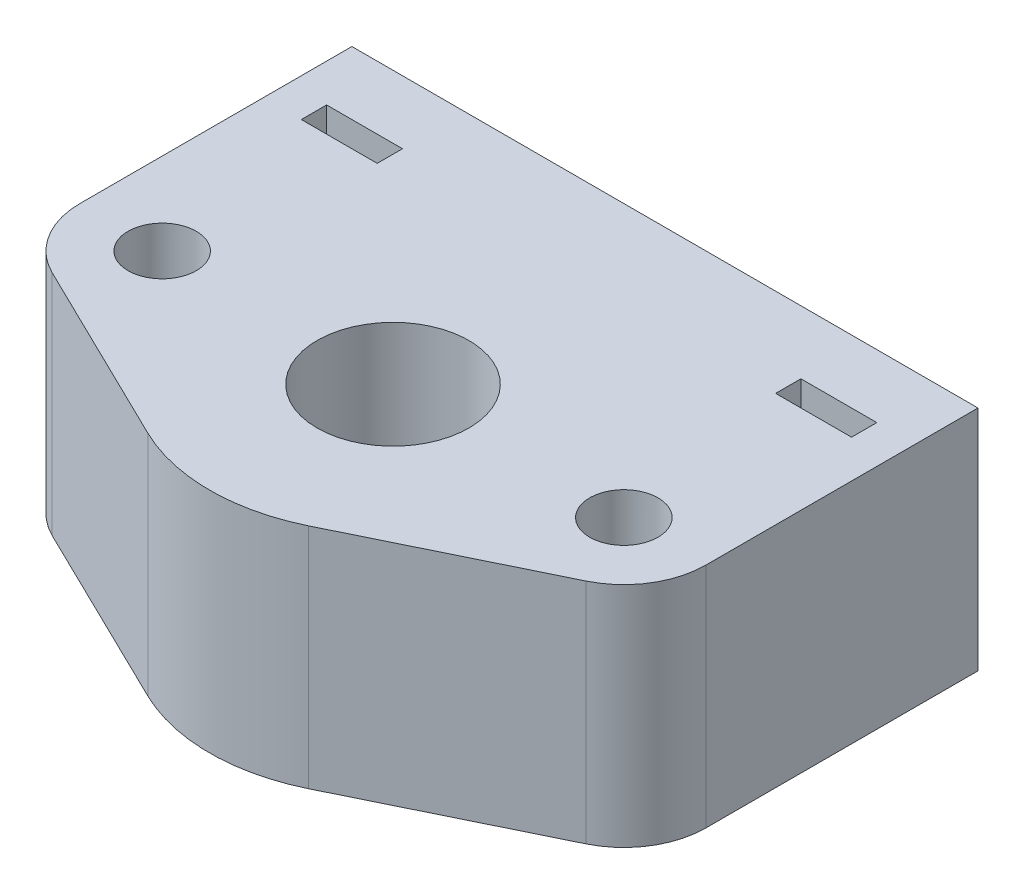
from build123d import *
from build123d.topology import SkipClean

# Parameters (mm, degrees)
BOSS_EXTRUDE1_DEPTH      = 12
BOSS_EXTRUDE1_DEPTH_BACK = 6
SKETCH1_R                = 2.7
SKETCH3_R                = 1.7
CUT_EXTRUDE1_DEPTH       = 10
CUT_EXTRUDE2_START       = -5
CUT_EXTRUDE2_DEPTH       = 2
CUT_EXTRUDE3_DEPTH       = 10


with BuildPart() as part:
    # Sketch1 → Boss-Extrude1 (new, two sides: drawn at the far end of the back side and taken through both)
    with BuildSketch(Plane(origin=(0, 0, 0), x_dir=(1, 0, 0), z_dir=(0, 1, 0)).offset(-BOSS_EXTRUDE1_DEPTH_BACK)):
        with BuildLine():
            Line((-24.75, 0), (-24.75, -21.5))
            ThreePointArc((-24.75, -21.5), (-23.762283916, -24.944521161), (-21.099315068, -27.342208798))
            Line((-21.099315068, -27.342208798), (-6.356164384, -34.532619627))
            ThreePointArc((-6.356164384, -34.532619627), (-3.261672532, -35.628393125), (0, -36))
            Line((0, -36), (0, -27.5))
            ThreePointArc((0, -27.5), (-6, -21.5), (0, -15.5))
            Line((0, -15.5), (0, 0))
            Line((0, 0), (-24.75, 0))
        make_face()
        with Locations(Location((-18.25, -21.5, 0), (0, 0, 270))):
            Circle(SKETCH1_R, mode=Mode.SUBTRACT)
    extrude(amount=BOSS_EXTRUDE1_DEPTH + BOSS_EXTRUDE1_DEPTH_BACK)

    # Sketch3 → Cut-Extrude1 (cut)
    with BuildSketch(Plane(origin=(0, 0, 0), x_dir=(-1, 0, 0), z_dir=(0, 0, -1))):
        with Locations((18.75, 6)):
            Circle(SKETCH3_R)
        with BuildLine():
            Line((0, 1.7), (0, -1.7))
            ThreePointArc((0, -1.7), (1.7, 0), (0, 1.7))
        make_face()
    extrude(amount=-CUT_EXTRUDE1_DEPTH, mode=Mode.SUBTRACT)

    # Sketch4 → Cut-Extrude2 (cut)
    with BuildSketch(Plane(origin=(0, 0, 0), x_dir=(-1, 0, 0), z_dir=(0, 0, -1)).offset(CUT_EXTRUDE2_START)):
        Polygon((15.75, 9), (15.75, 12), (21.75, 12), (21.75, 9), (21.75, 3), (15.75, 3), align=None)
        Polygon((0, 3), (3, 3), (3, 0), (3, -6), (0, -6), align=None)
    extrude(amount=-CUT_EXTRUDE2_DEPTH, mode=Mode.SUBTRACT)

    # Sketch6 → Cut-Extrude3 (cut)
    with BuildSketch(Plane.XZ.offset(6)):
        Polygon((-14, 23.953738644), (-18.25, 26.407477288), (-22.5, 23.953738644), (-22.5, 19.046261356), (-18.25, 16.592522712), (-14, 19.046261356), align=None)
    extrude(amount=-CUT_EXTRUDE3_DEPTH, mode=Mode.SUBTRACT)

    # Mirror1: part across plane


with BuildPart() as part_1:
    with SkipClean():  # the faces are left unmerged after this step: merging them gives an invalid solid
        add(part.part)
        add(part.part.mirror(Plane(origin=(0, -6, 0), x_dir=(0, 0, 1), z_dir=(1, 0, 0))))


solid = part_1.part
